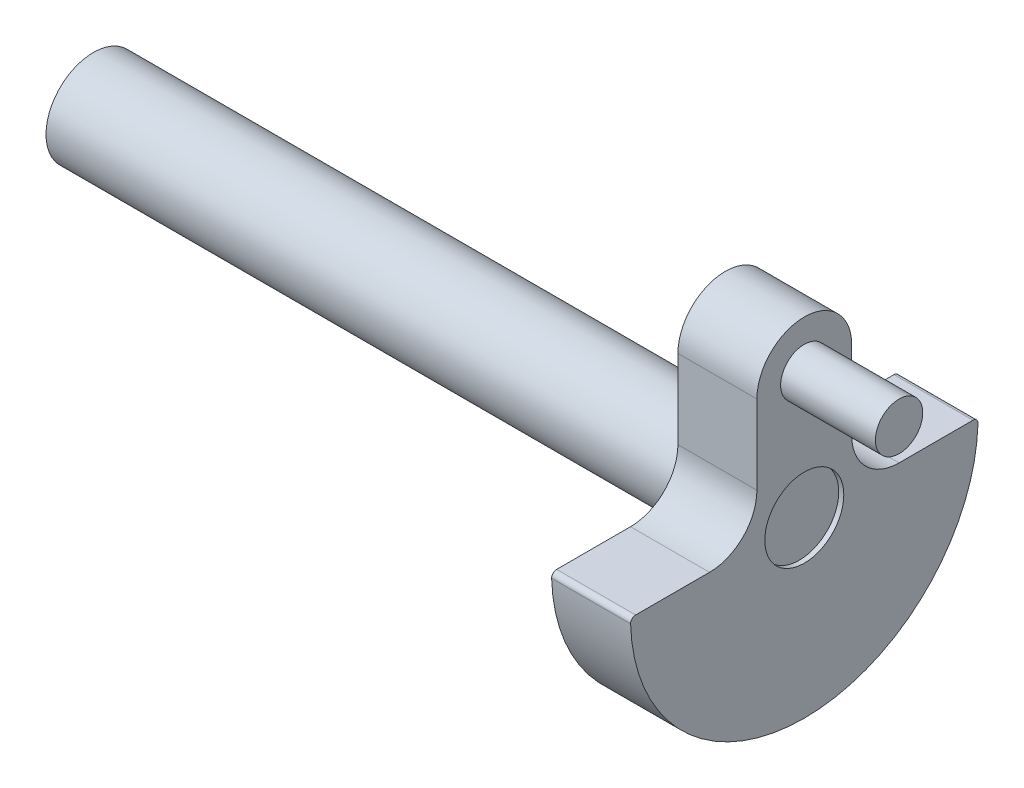
from build123d import *

# Parameters (mm, degrees)
BOSS_EXTRUDE1_DEPTH = 3.96875
SKETCH4_R           = 2.38125
BOSS_EXTRUDE2_DEPTH = 31.75
SKETCH4_3_R         = 1.190625
BOSS_EXTRUDE3_DEPTH = 8.73125
SKETCH5_R           = 1.984375
CUT_EXTRUDE1_DEPTH  = 0.254


with BuildPart() as part:
    # Sketch3 → Boss-Extrude1 (new body)
    with BuildSketch(Plane(origin=(0, 0, 0), x_dir=(0, 0, -1), z_dir=(1, 0, 0))):
        with BuildLine():
            Line((-2.38125, 6.35), (-2.38125, 2.38125))
            ThreePointArc((-2.38125, 2.38125), (-3.078701977, 0.697451977), (-4.7625, 0))
            Line((-4.7625, 0), (-8.473443902, 0))
            ThreePointArc((-8.473443902, 0), (-8.655719879, -0.077106054), (-8.727329862, -0.261610487))
            ThreePointArc((-8.727329862, -0.261610487), (0, -8.73125), (8.727329862, -0.261610487))
            ThreePointArc((8.727329862, -0.261610487), (8.655719879, -0.077106054), (8.473443902, 0))
            Line((8.473443902, 0), (4.7625, 0))
            ThreePointArc((4.7625, 0), (3.078701977, 0.697451977), (2.38125, 2.38125))
            Line((2.38125, 2.38125), (2.38125, 6.35))
            ThreePointArc((2.38125, 6.35), (0, 8.73125), (-2.38125, 6.35))
        make_face()
    extrude(amount=BOSS_EXTRUDE1_DEPTH)

    # Sketch4 → Boss-Extrude2 (add)
    with BuildSketch(Plane.ZY):
        Circle(SKETCH4_R)
    extrude(amount=BOSS_EXTRUDE2_DEPTH)

    # Sketch4<3> → Boss-Extrude3 (add)
    with BuildSketch(Plane.ZY):
        with Locations((0, 6.35)):
            Circle(SKETCH4_3_R)
    extrude(amount=-BOSS_EXTRUDE3_DEPTH)

    # Sketch5 → Cut-Extrude1 (cut)
    with BuildSketch(Plane(origin=(3.96875, 0, 0), x_dir=(0, 0, -1), z_dir=(1, 0, 0))):
        Circle(SKETCH5_R)
    extrude(amount=-CUT_EXTRUDE1_DEPTH, mode=Mode.SUBTRACT)


solid = part.part
